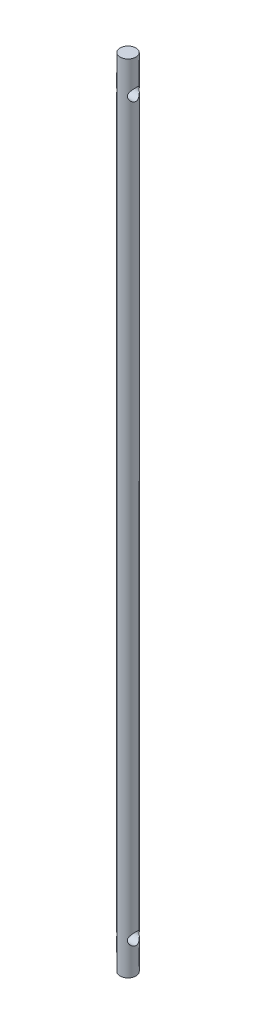
from build123d import *

# Parameters (mm, degrees)
SKETCH_1_R          = 2
EXTRUDE_1_DEPTH     = 200
SKETCH_2_R          = 1.5
CUT_EXTRUDE_3_DEPTH = 100


with BuildPart() as part:
    # 草图1 → 凸台-拉伸1 (new body)
    with BuildSketch(Plane(origin=(0, 0, 0), x_dir=(1, 0, 0), z_dir=(0, 1, 0))):
        with Locations(Location((0, 0, 0), (0, 0, 270))):
            Circle(SKETCH_1_R)
    extrude(amount=EXTRUDE_1_DEPTH)

    # 草图2 → 切除-拉伸3 (cut, symmetric)
    with BuildSketch(Plane(origin=(0, 0, 0), x_dir=(0, 0, -1), z_dir=(1, 0, 0))):
        with Locations((0, 8.147150069)):
            Circle(SKETCH_2_R)
        with Locations((0, 191.852849931)):
            Circle(SKETCH_2_R)
    extrude(amount=CUT_EXTRUDE_3_DEPTH, both=True, mode=Mode.SUBTRACT)


solid = part.part
